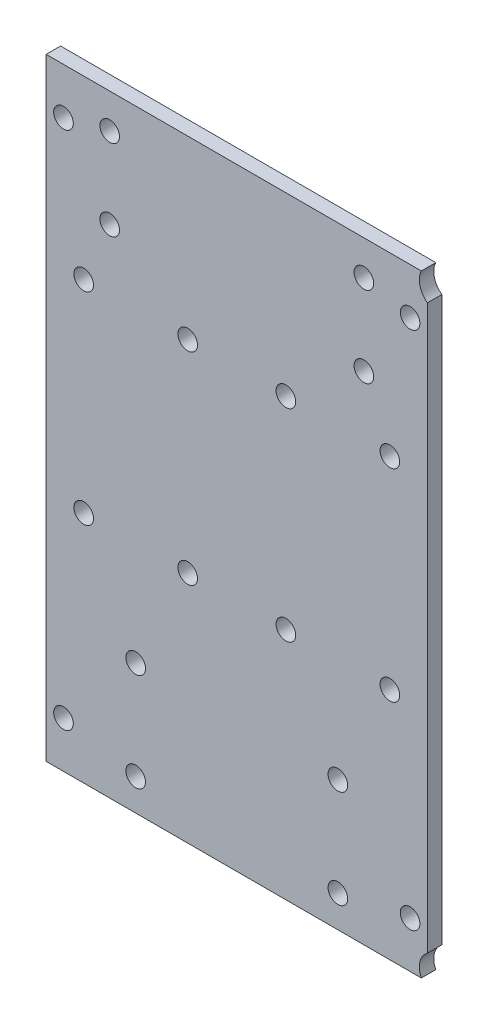
from build123d import *

# Parameters (mm, degrees)
MAIN_PROFILE_SKETCH_R = 1.7
MAIN_EXTRUSION_DEPTH  = 2.5


with BuildPart() as part:
    # Main Profile Sketch → Main Extrusion (new body)
    with BuildSketch(Plane.XY.offset(69)):
        with BuildLine():
            Line((-158, 53), (-93.05122926, 53))
            ThreePointArc((-93.05122926, 53), (-93.300513342, 50.683537094), (-92, 48.750454583))
            Line((-92, 48.750454583), (-92, -48.750454583))
            ThreePointArc((-92, -48.750454583), (-93.300513342, -50.683537094), (-93.05122926, -53))
            Line((-93.05122926, -53), (-158, -53))
            Line((-158, -53), (-158, 53))
        make_face()
        with Locations((-155, -45)):
            Circle(MAIN_PROFILE_SKETCH_R, mode=Mode.SUBTRACT)
        with Locations((-142.5, -47.5)):
            Circle(MAIN_PROFILE_SKETCH_R, mode=Mode.SUBTRACT)
        with Locations((-142.5, -30.5)):
            Circle(MAIN_PROFILE_SKETCH_R, mode=Mode.SUBTRACT)
        with Locations((-151.5, -12.5)):
            Circle(MAIN_PROFILE_SKETCH_R, mode=Mode.SUBTRACT)
        with Locations((-133.5, -12.5)):
            Circle(MAIN_PROFILE_SKETCH_R, mode=Mode.SUBTRACT)
        with Locations((-107.5, -47.5)):
            Circle(MAIN_PROFILE_SKETCH_R, mode=Mode.SUBTRACT)
        with Locations((-95, -45)):
            Circle(MAIN_PROFILE_SKETCH_R, mode=Mode.SUBTRACT)
        with Locations((-107.5, -30.5)):
            Circle(MAIN_PROFILE_SKETCH_R, mode=Mode.SUBTRACT)
        with Locations((-116.5, -12.5)):
            Circle(MAIN_PROFILE_SKETCH_R, mode=Mode.SUBTRACT)
        with Locations((-98.5, -12.5)):
            Circle(MAIN_PROFILE_SKETCH_R, mode=Mode.SUBTRACT)
        with Locations((-151.5, 22.5)):
            Circle(MAIN_PROFILE_SKETCH_R, mode=Mode.SUBTRACT)
        with Locations((-133.5, 22.5)):
            Circle(MAIN_PROFILE_SKETCH_R, mode=Mode.SUBTRACT)
        with Locations((-147, 33)):
            Circle(MAIN_PROFILE_SKETCH_R, mode=Mode.SUBTRACT)
        with Locations((-155, 45)):
            Circle(MAIN_PROFILE_SKETCH_R, mode=Mode.SUBTRACT)
        with Locations((-147, 47)):
            Circle(MAIN_PROFILE_SKETCH_R, mode=Mode.SUBTRACT)
        with Locations((-116.5, 22.5)):
            Circle(MAIN_PROFILE_SKETCH_R, mode=Mode.SUBTRACT)
        with Locations((-98.5, 22.5)):
            Circle(MAIN_PROFILE_SKETCH_R, mode=Mode.SUBTRACT)
        with Locations((-103, 33)):
            Circle(MAIN_PROFILE_SKETCH_R, mode=Mode.SUBTRACT)
        with Locations((-103, 47)):
            Circle(MAIN_PROFILE_SKETCH_R, mode=Mode.SUBTRACT)
        with Locations((-95, 45)):
            Circle(MAIN_PROFILE_SKETCH_R, mode=Mode.SUBTRACT)
    extrude(amount=-MAIN_EXTRUSION_DEPTH)


solid = part.part
